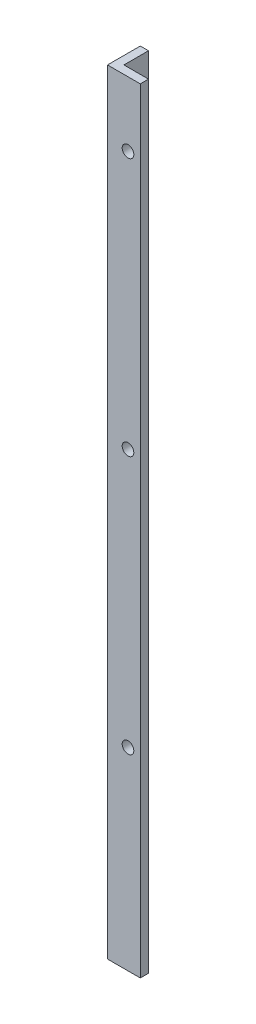
from build123d import *

# Parameters (mm, degrees)
BOSS_EXTRUDE1_DEPTH = 300
SKETCH2_R           = 2.25
CUT_EXTRUDE1_DEPTH  = 10
SKETCH3_R           = 2.25
CUT_EXTRUDE2_DEPTH  = 10
SKETCH4_R           = 1.85
CUT_EXTRUDE3_DEPTH  = 301.537152445


with BuildPart() as part:
    # Sketch1 → Boss-Extrude1 (new body)
    with BuildSketch(Plane(origin=(0, 0, 0), x_dir=(1, 0, 0), z_dir=(0, 1, 0))):
        Polygon((0, 0), (12.7, 0), (12.7, 3.18), (3.18, 3.18), (3.18, 12.7), (0, 12.7), align=None)
    extrude(amount=BOSS_EXTRUDE1_DEPTH)

    # Sketch2 → Cut-Extrude1 (cut)
    with BuildSketch(Plane(origin=(0, 0, -3.18), x_dir=(-1, 0, 0), z_dir=(0, 0, -1))):
        with Locations((-7.94, 275)):
            Circle(SKETCH2_R)
        with Locations((-7.94, 175)):
            Circle(SKETCH2_R)
        with Locations((-7.94, 75)):
            Circle(SKETCH2_R)
    extrude(amount=-CUT_EXTRUDE1_DEPTH, mode=Mode.SUBTRACT)

    # Sketch3 → Cut-Extrude2 (cut)
    with BuildSketch(Plane(origin=(3.18, 0, 0), x_dir=(0, 0, -1), z_dir=(1, 0, 0))):
        with Locations((7.94, 225)):
            Circle(SKETCH3_R)
        with Locations((7.94, 125)):
            Circle(SKETCH3_R)
        with Locations((7.94, 25)):
            Circle(SKETCH3_R)
    extrude(amount=-CUT_EXTRUDE2_DEPTH, mode=Mode.SUBTRACT)

    # Sketch4 → Cut-Extrude3 (cut, through all)
    with BuildSketch(Plane.ZY):
        with Locations((-7.94, 253.6)):
            Circle(SKETCH4_R)
    extrude(amount=-CUT_EXTRUDE3_DEPTH, mode=Mode.SUBTRACT)


solid = part.part
